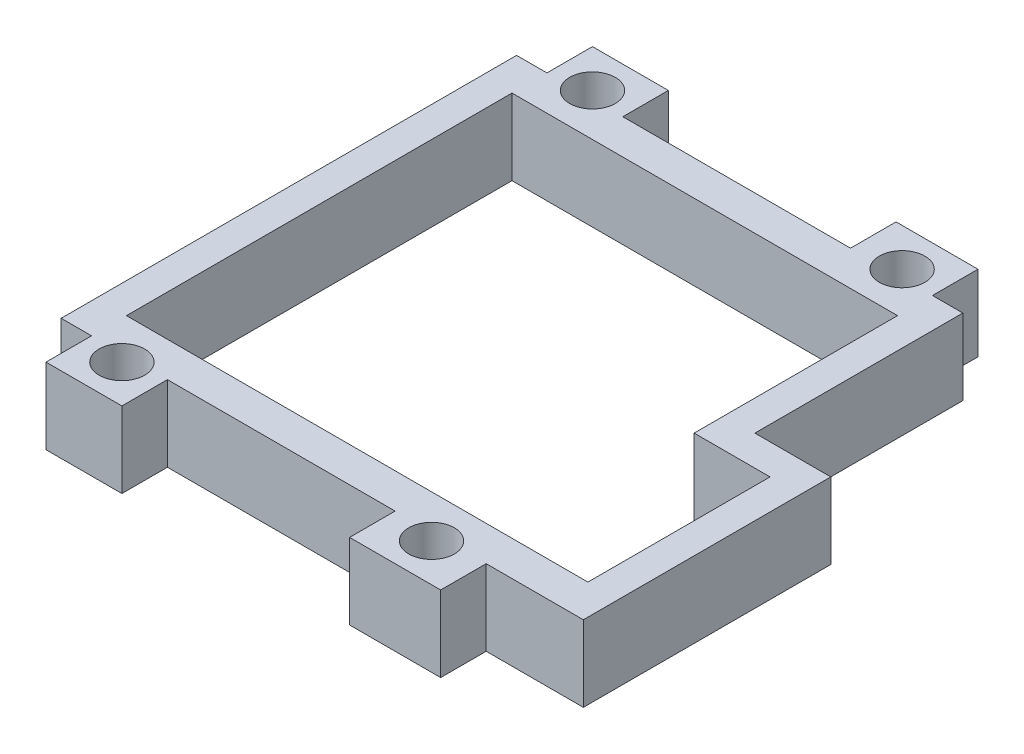
from build123d import *

# Parameters (mm, degrees)
SKETCH1_W           = 34.4
SKETCH1_H           = 36
BOSS_EXTRUDE1_DEPTH = 5
SKETCH4_R           = 1.5
CUT_EXTRUDE2_DEPTH  = 5
SKETCH4_3_R         = 1.5
SKETCH4_3_W         = 25.4
SKETCH4_3_H         = 25.4
CUT_EXTRUDE3_DEPTH  = 26.393700006
SKETCH7_W           = 5
SKETCH7_H           = 12
CUT_EXTRUDE4_DEPTH  = 5
SKETCH8_W           = 15
SKETCH8_H           = 3
CUT_EXTRUDE5_DEPTH  = 26.393700006
SKETCH9_W           = 6.4
SKETCH9_H           = 3
CUT_EXTRUDE6_DEPTH  = 26.393700006
SKETCH10_W          = 2
SKETCH10_H          = 3
CUT_EXTRUDE7_DEPTH  = 26.393700006
SKETCH11_W          = 2
SKETCH11_H          = 3
SKETCH11_W_2        = 15
CUT_EXTRUDE8_DEPTH  = 26.393700006
SKETCH12_W          = 5
SKETCH12_H          = 16.7
CUT_EXTRUDE9_DEPTH  = 26.393700006
SKETCH13_W          = 2
SKETCH13_H          = 3
CUT_EXTRUDE10_DEPTH = 26.393700006


with BuildPart() as part:
    # Sketch1 → Boss-Extrude1 (new body)
    with BuildSketch(Plane(origin=(0, 0, 0), x_dir=(1, 0, 0), z_dir=(0, 1, 0))):
        Rectangle(SKETCH1_W, SKETCH1_H)
    extrude(amount=BOSS_EXTRUDE1_DEPTH)

    # Sketch4 → Cut-Extrude2 (cut)
    with BuildSketch(Plane(origin=(0, 5, 0), x_dir=(1, 0, 0), z_dir=(0, 1, 0))):
        with Locations((-12.7, 15.5)):
            Circle(SKETCH4_R)
    extrude(amount=-CUT_EXTRUDE2_DEPTH, mode=Mode.SUBTRACT)

    # Sketch4<3> → Cut-Extrude3 (cut, through all)
    with BuildSketch(Plane(origin=(0, 5, 0), x_dir=(1, 0, 0), z_dir=(0, 1, 0))):
        with Locations((-12.7, 15.5)):
            Circle(SKETCH4_3_R)
        with Locations((7.7, 15.5)):
            Circle(SKETCH4_3_R)
        with Locations((7.7, -15.5)):
            Circle(SKETCH4_3_R)
        with Locations((-12.7, -15.5)):
            Circle(SKETCH4_3_R)
        with Locations((-2.5, 0)):
            Rectangle(SKETCH4_3_W, SKETCH4_3_H)
    extrude(amount=-CUT_EXTRUDE3_DEPTH, mode=Mode.SUBTRACT)

    # Sketch7 → Cut-Extrude4 (cut)
    with BuildSketch(Plane(origin=(0, 5, 0), x_dir=(1, 0, 0), z_dir=(0, 1, 0))):
        with Locations((12.7, -6.7)):
            Rectangle(SKETCH7_W, SKETCH7_H)
    extrude(amount=-CUT_EXTRUDE4_DEPTH, mode=Mode.SUBTRACT)

    # Sketch8 → Cut-Extrude5 (cut, through all)
    with BuildSketch(Plane(origin=(0, 5, 0), x_dir=(1, 0, 0), z_dir=(0, 1, 0))):
        with Locations((-2.7, -16.5)):
            Rectangle(SKETCH8_W, SKETCH8_H)
    extrude(amount=-CUT_EXTRUDE5_DEPTH, mode=Mode.SUBTRACT)

    # Sketch9 → Cut-Extrude6 (cut, through all)
    with BuildSketch(Plane(origin=(0, 5, 0), x_dir=(1, 0, 0), z_dir=(0, 1, 0))):
        with Locations((14, -16.5)):
            Rectangle(SKETCH9_W, SKETCH9_H)
    extrude(amount=-CUT_EXTRUDE6_DEPTH, mode=Mode.SUBTRACT)

    # Sketch10 → Cut-Extrude7 (cut, through all)
    with BuildSketch(Plane(origin=(0, 5, 0), x_dir=(1, 0, 0), z_dir=(0, 1, 0))):
        with Locations((-16.2, -16.5)):
            Rectangle(SKETCH10_W, SKETCH10_H)
    extrude(amount=-CUT_EXTRUDE7_DEPTH, mode=Mode.SUBTRACT)

    # Sketch11 → Cut-Extrude8 (cut, through all)
    with BuildSketch(Plane(origin=(0, 5, 0), x_dir=(1, 0, 0), z_dir=(0, 1, 0))):
        with Locations((-16.2, 16.5)):
            Rectangle(SKETCH11_W, SKETCH11_H)
        with Locations((-2.7, 16.5)):
            Rectangle(SKETCH11_W_2, SKETCH11_H)
    extrude(amount=-CUT_EXTRUDE8_DEPTH, mode=Mode.SUBTRACT)

    # Sketch12 → Cut-Extrude9 (cut, through all)
    with BuildSketch(Plane(origin=(0, 5, 0), x_dir=(1, 0, 0), z_dir=(0, 1, 0))):
        with Locations((14.7, 9.65)):
            Rectangle(SKETCH12_W, SKETCH12_H)
    extrude(amount=-CUT_EXTRUDE9_DEPTH, mode=Mode.SUBTRACT)

    # Sketch13 → Cut-Extrude10 (cut, through all)
    with BuildSketch(Plane(origin=(0, 5, 0), x_dir=(1, 0, 0), z_dir=(0, 1, 0))):
        with Locations((11.2, 16.5)):
            Rectangle(SKETCH13_W, SKETCH13_H)
    extrude(amount=-CUT_EXTRUDE10_DEPTH, mode=Mode.SUBTRACT)


solid = part.part
